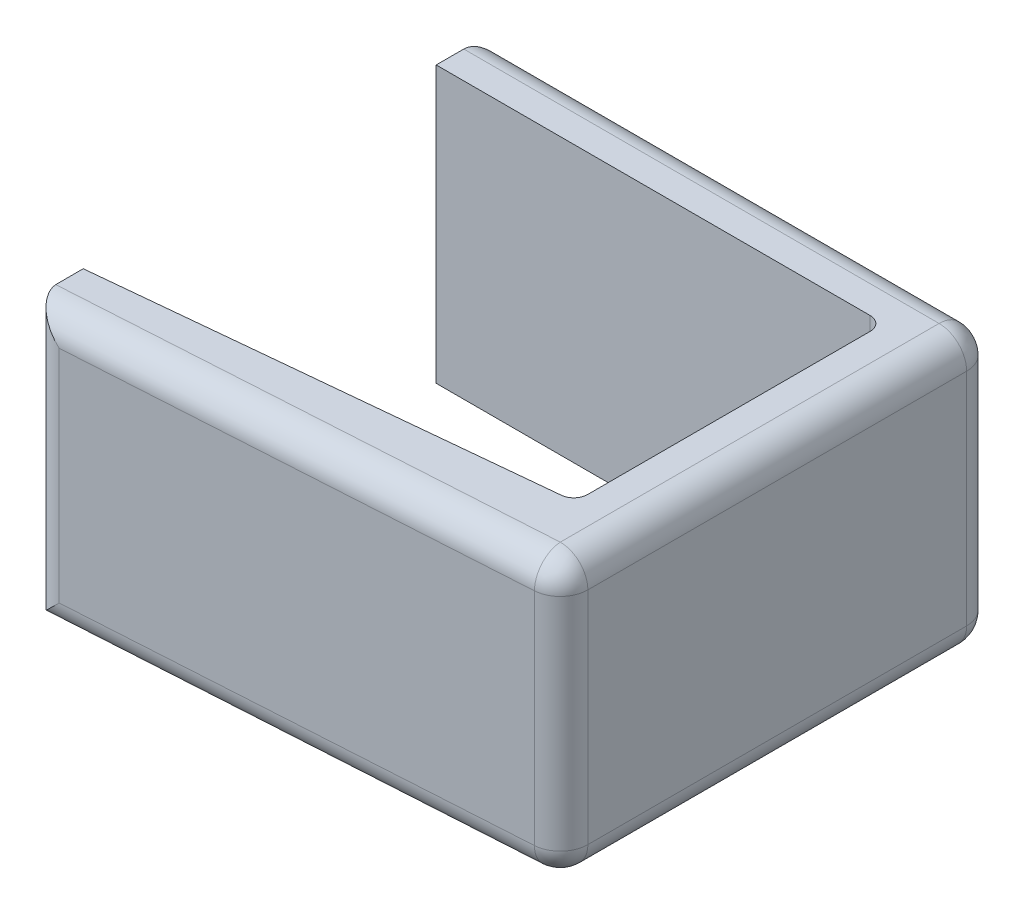
from build123d import *

# Parameters (mm, degrees)
BOSS_EXTRUDE1_DEPTH = 10
FILLET1_R           = 1
FILLET2_R           = 0.5


with BuildPart() as part:
    # Sketch1 → Boss-Extrude1 (new body)
    with BuildSketch(Plane(origin=(0, 0, 0), x_dir=(1, 0, 0), z_dir=(0, 1, 0))):
        Polygon((-8.118577075, -4.9), (-8.118577075, -6.9), (10.118577075, -5.776825706), (10.118577075, 9.9), (-8.118577075, 9.9), (-8.118577075, 7.9), (8.118577075, 7.9), (8.118577075, -3.3), align=None)
    extrude(amount=BOSS_EXTRUDE1_DEPTH)

    # Fillet1
    fillet1_edges = [part.edges().sort_by_distance(p)[0] for p in [
        (1, 0, -9.9),
        (10.118577075, 0, -2.061587147),
        (1, 0, 6.338412853),
        (-8.118577075, 5, -9.9),
        (10.118577075, 5, -9.9),
        (10.118577075, 5, 5.776825706),
        (-8.118577075, 5, 6.9),
        (1, 10, 6.338412853),
        (10.118577075, 10, -2.061587147),
        (1, 10, -9.9),
    ]]
    fillet(fillet1_edges, radius=FILLET1_R)

    # Fillet2
    fillet2_edges = [part.edges().sort_by_distance(p)[0] for p in [
        (8.118577075, 5, -7.9),
        (8.118577075, 5, 3.3),
    ]]
    fillet(fillet2_edges, radius=FILLET2_R)


solid = part.part
